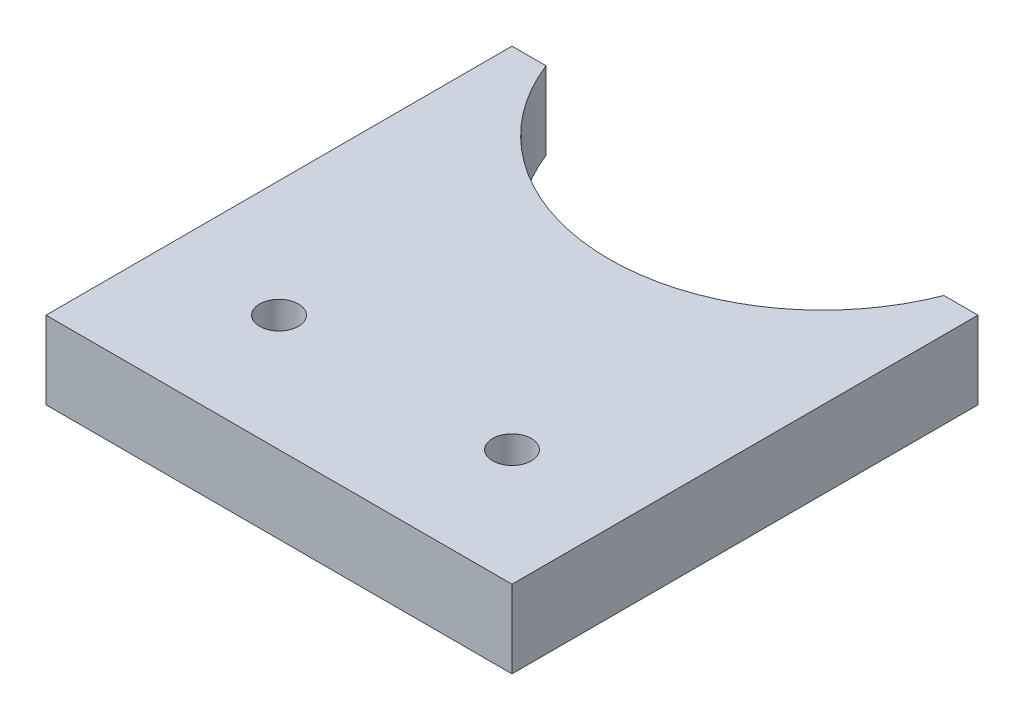
from build123d import *

# Parameters (mm, degrees)
BOSS_EXTRUDE1_DEPTH = 12.7
SKETCH2_R           = 3.175
CUT_EXTRUDE1_DEPTH  = 12.7


with BuildPart() as part:
    # Sketch1 → Boss-Extrude1 (new body)
    with BuildSketch(Plane(origin=(0, 0, 0), x_dir=(1, 0, 0), z_dir=(0, 1, 0))):
        with BuildLine():
            Line((38.1, 38.1), (32.534068682, 38.1))
            ThreePointArc((32.534068682, 38.1), (0, 15.875), (-32.534068682, 38.1))
            Line((-32.534068682, 38.1), (-38.1, 38.1))
            Line((-38.1, 38.1), (-38.1, -38.1))
            Line((-38.1, -38.1), (38.1, -38.1))
            Line((38.1, -38.1), (38.1, 38.1))
        make_face()
    extrude(amount=BOSS_EXTRUDE1_DEPTH)

    # Sketch2 → Cut-Extrude1 (cut)
    with BuildSketch(Plane(origin=(0, 12.7, 0), x_dir=(1, 0, 0), z_dir=(0, 1, 0))):
        with Locations(Location((-19.05, -19.05, 0), (0, 0, 270))):
            Circle(SKETCH2_R)
        with Locations(Location((19.05, -19.05, 0), (0, 0, 90))):
            Circle(SKETCH2_R)
    extrude(amount=-CUT_EXTRUDE1_DEPTH, mode=Mode.SUBTRACT)


solid = part.part
